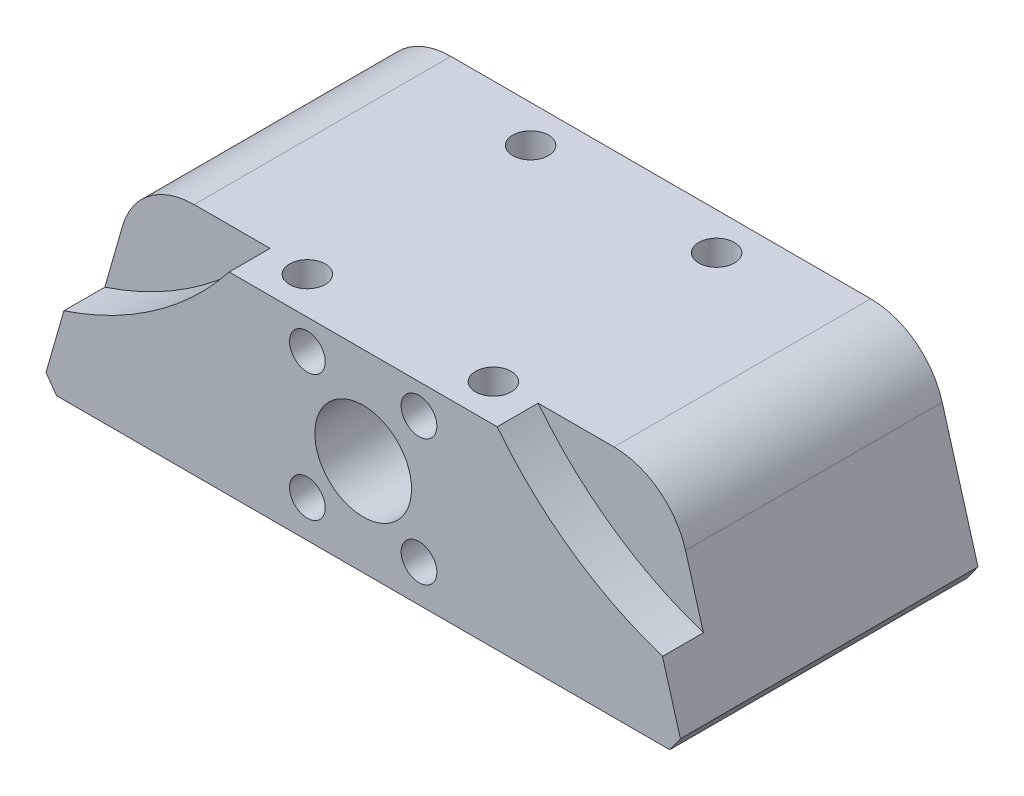
from build123d import *

# Parameters (mm, degrees)
SKETCH_1_R          = 2.4
SKETCH_1_R_2        = 6.5
EXTRUDE_1_DEPTH     = 40
FILLET_1_R          = 10
SKETCH_2_R          = 2.4
CUT_EXTRUDE_1_DEPTH = 70.61896589
SKETCH_4_R          = 47
CUT_EXTRUDE_2_DEPTH = 5.5
CUT_EXTRUDE_3_DEPTH = 68.9102379


with BuildPart() as part:
    # 草图1 → 凸台-拉伸1 (new body)
    with BuildSketch(Plane.XY):
        Polygon((-35.703061166, -5), (50.703061166, -5), (43.247681137, 21), (-28.247681137, 21), align=None)
        with Locations((15, 17)):
            Circle(SKETCH_1_R, mode=Mode.SUBTRACT)
        with Locations((15, 0)):
            Circle(SKETCH_1_R, mode=Mode.SUBTRACT)
        Circle(SKETCH_1_R, mode=Mode.SUBTRACT)
        with Locations((0, 17)):
            Circle(SKETCH_1_R, mode=Mode.SUBTRACT)
        with Locations((7.5, 8)):
            Circle(SKETCH_1_R_2, mode=Mode.SUBTRACT)
    extrude(amount=EXTRUDE_1_DEPTH)

    # 圆角1
    fillet_1_edges = [part.edges().sort_by_distance(p)[0] for p in [
        (-28.247681137, 21, 20),
        (43.247681137, 21, 20),
    ]]
    fillet(fillet_1_edges, radius=FILLET_1_R)

    # 草图2 → 切除-拉伸1 (cut, through all)
    with BuildSketch(Plane(origin=(0, 21, 0), x_dir=(1, 0, 0), z_dir=(0, 1, 0))):
        with Locations(Location((-5, -5, 0), (0, 0, 180))):
            Circle(SKETCH_2_R)
        with Locations(Location((20, -5, 0), (0, 0, 180))):
            Circle(SKETCH_2_R)
        with Locations(Location((-5, -35, 0), (0, 0, 180))):
            Circle(SKETCH_2_R)
        with Locations(Location((20, -35, 0), (0, 0, 180))):
            Circle(SKETCH_2_R)
    extrude(amount=-CUT_EXTRUDE_1_DEPTH, mode=Mode.SUBTRACT)

    # 草图4 → 切除-拉伸2 (cut)
    with BuildSketch(Plane.XY.offset(40)):
        with Locations((-47.5, 50)):
            Circle(SKETCH_4_R)
        with Locations((62.5, 50)):
            Circle(SKETCH_4_R)
    extrude(amount=-CUT_EXTRUDE_2_DEPTH, mode=Mode.SUBTRACT)

    # 草图5 → 切除-拉伸3 (cut, through all)
    with BuildSketch(Plane(origin=(0, 0, 0), x_dir=(-1, 0, 0), z_dir=(0, 0, -1))):
        Polygon((-48.703061166, -5), (-50.703061166, -5), (-50.129570395, -3), align=None)
        Polygon((35.129570395, -3), (33.703061166, -5), (35.703061166, -5), align=None)
    extrude(amount=-CUT_EXTRUDE_3_DEPTH, mode=Mode.SUBTRACT)


solid = part.part
